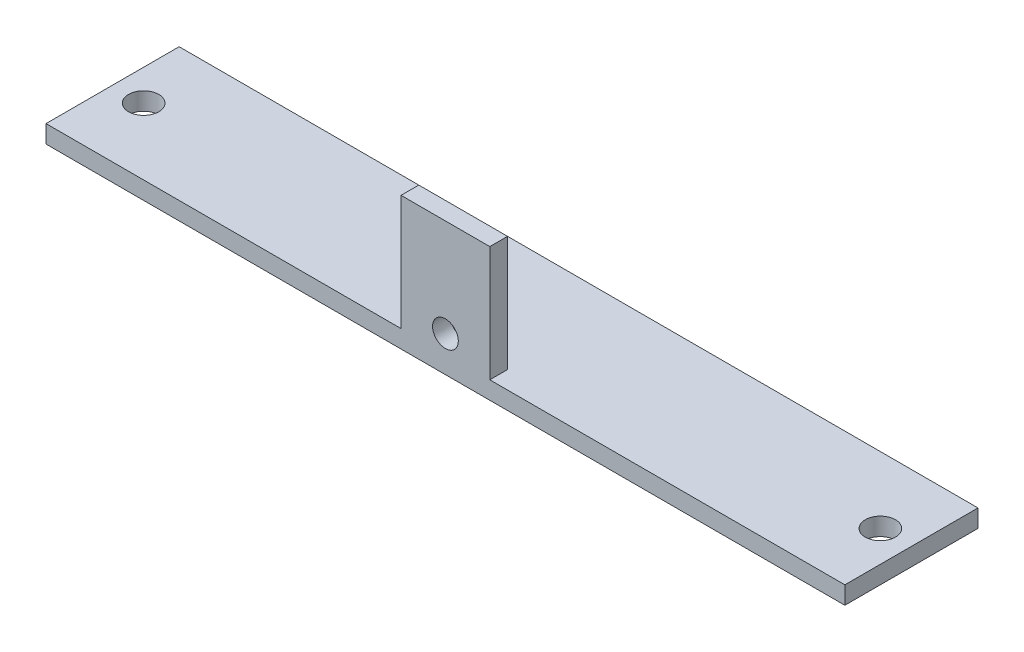
from build123d import *

# Parameters (mm, degrees)
ESQUISSE1_W             = 90
ESQUISSE1_H             = 15
BOSS_EXTRU_1_DEPTH      = 15
ESQUISSE2_W             = 13
ESQUISSE2_H             = 13
ENL_V_MAT_EXTRU_1_DEPTH = 92.549167118
D_GAGEMENT_M31_D        = 3.4
D_GAGEMENT_M31_DEPTH    = 24
D_GAGEMENT_M31_TIP      = 1.021463052
ESQUISSE5_W             = 40
ESQUISSE5_H             = 13
ENL_V_MAT_EXTRU_2_DEPTH = 50.183330509
D_GAGEMENT_M2_51_D      = 2.9
D_GAGEMENT_M2_51_DEPTH  = 24
D_GAGEMENT_M2_51_TIP    = 0.871247898


with BuildPart() as part:
    # Esquisse1 → Boss.-Extru.1 (new body)
    with BuildSketch(Plane(origin=(0, 0, 0), x_dir=(1, 0, 0), z_dir=(0, 1, 0))):
        Rectangle(ESQUISSE1_W, ESQUISSE1_H)
    extrude(amount=BOSS_EXTRU_1_DEPTH)

    # Esquisse2 → Enlèv. mat.-Extru.1 (cut, through all)
    with BuildSketch(Plane.ZY.offset(45)):
        with Locations((-1, 8.5)):
            Rectangle(ESQUISSE2_W, ESQUISSE2_H)
    extrude(amount=-ENL_V_MAT_EXTRU_1_DEPTH, mode=Mode.SUBTRACT)

    # Dégagement M31
    with Locations(Plane(origin=(0, 2, 0), x_dir=(1, 0, 0), z_dir=(0, 1, 0))):
        with Locations((-41.5, 0), (41.5, 0)):
            Hole(D_GAGEMENT_M31_D / 2, depth=D_GAGEMENT_M31_DEPTH)
            with Locations((0, 0, -(D_GAGEMENT_M31_DEPTH + D_GAGEMENT_M31_TIP / 2))):  # 118° drill point
                Cone(0, D_GAGEMENT_M31_D / 2, D_GAGEMENT_M31_TIP, mode=Mode.SUBTRACT)

    # Esquisse5 → Enlèv. mat.-Extru.2 (cut, through all)
    with BuildSketch(Plane(origin=(0, 0, 5.5), x_dir=(-1, 0, 0), z_dir=(0, 0, -1))):
        with Locations((25, 8.5)):
            Rectangle(ESQUISSE5_W, ESQUISSE5_H)
        with Locations((-25, 8.5)):
            Rectangle(ESQUISSE5_W, ESQUISSE5_H)
    extrude(amount=-ENL_V_MAT_EXTRU_2_DEPTH, mode=Mode.SUBTRACT)

    # Dégagement M2.51
    with Locations(Plane(origin=(0, 0, 5.5), x_dir=(-1, 0, 0), z_dir=(0, 0, -1))):
        with Locations((0, 4)):
            Hole(D_GAGEMENT_M2_51_D / 2, depth=D_GAGEMENT_M2_51_DEPTH)
            with Locations((0, 0, -(D_GAGEMENT_M2_51_DEPTH + D_GAGEMENT_M2_51_TIP / 2))):  # 118° drill point
                Cone(0, D_GAGEMENT_M2_51_D / 2, D_GAGEMENT_M2_51_TIP, mode=Mode.SUBTRACT)


solid = part.part
